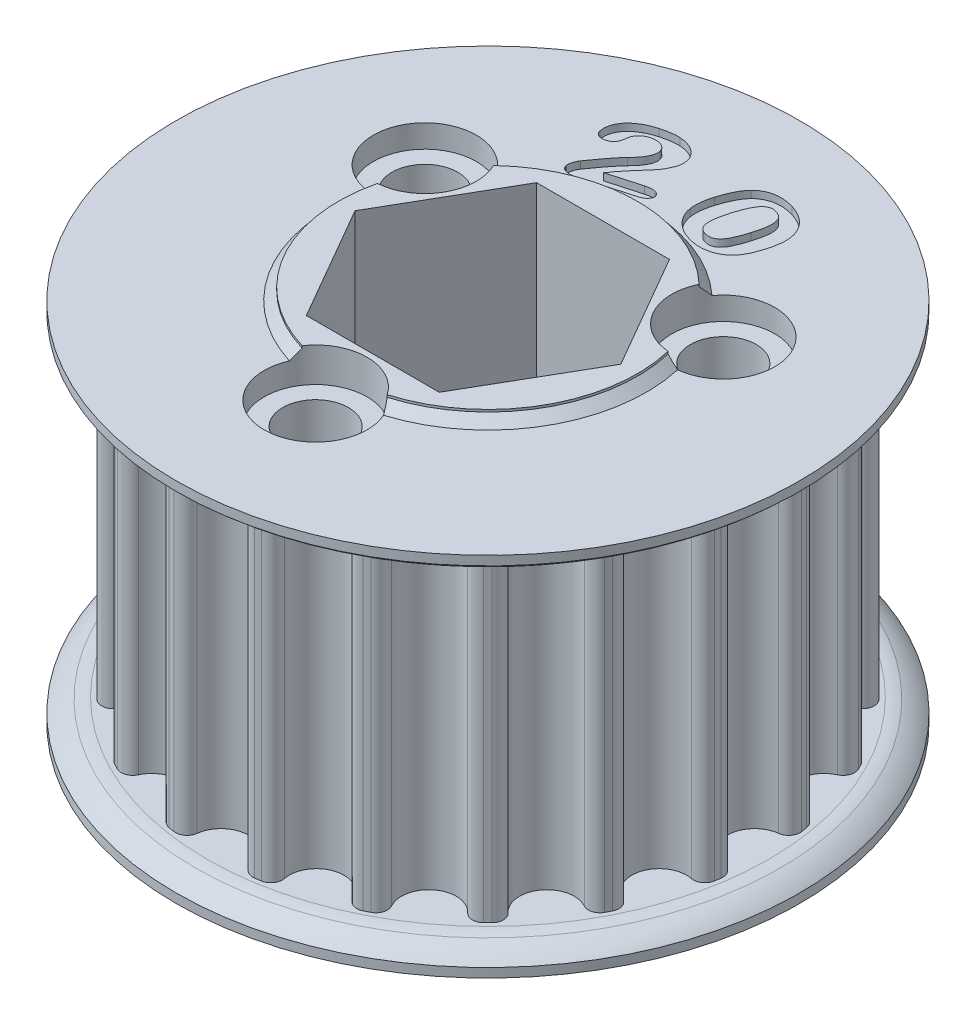
from build123d import *

# Parameters (mm, degrees)
SKETCH1_R               = 15.34399401
TOOTHOD_DEPTH           = 8.89
TOOTHPROFILE_DEPTH      = 29.053604124
TOOTHPATTERN_COUNT      = 20
SKETCH6_W               = 8.2931
SKETCH6_H               = 0.635
BORE_DEPTH              = 27.757745097
BORE_DEPTH_BACK         = 27.757745097
LARGE_TOOTH_COUNT_DEPTH = 0.4
CHAMFER1_SIZE           = 0.508
SKETCH11_R              = 12.3825
CUT_EXTRUDE2_DEPTH      = 3.302
SKETCH12_R              = 1.8288
CUT_EXTRUDE3_DEPTH      = 31.183991015
SKETCH13_R              = 12.3825
SKETCH13_R_2            = 1.35255
BOSS_EXTRUDE1_DEPTH     = 3.175
CUT_EXTRUDE4_DEPTH      = 32.817405686
CUT_EXTRUDE4_DEPTH_BACK = 1.27
SKETCH14_R              = 2.8575


with BuildPart() as part:
    # Sketch1 → ToothOD (new, symmetric)
    with BuildSketch(Plane(origin=(0, 0, 0), x_dir=(1, 0, 0), z_dir=(0, 1, 0))):
        with Locations(Location((0, 0, 0), (0, 0, 270))):
            Circle(SKETCH1_R)
    extrude(amount=TOOTHOD_DEPTH, both=True)

    # Sketch2 → ToothProfile (cut, through all)
    with BuildSketch(Plane(origin=(0, 8.89, 0), x_dir=(1, 0, 0), z_dir=(0, 1, 0))):
        with BuildLine():
            ThreePointArc((-1.514151189, 14.627414336), (0, 13.28399401), (1.514151189, 14.627414336))
            ThreePointArc((1.514151189, 14.627414336), (1.759047929, 15.056333772), (2.237219512, 15.180019797))
            ThreePointArc((2.237219512, 15.180019797), (0, 15.34399401), (-2.237219512, 15.180019797))
            ThreePointArc((-2.237219512, 15.180019797), (-1.759047929, 15.056333772), (-1.514151189, 14.627414336))
        make_face()
    toothprofile = extrude(amount=-TOOTHPROFILE_DEPTH, mode=Mode.SUBTRACT)

    # ToothPattern: ToothProfile ×20 about axis
    toothpattern_axis = Axis((0, 0, 0), (0, 1, 0))
    for i in range(1, TOOTHPATTERN_COUNT):
        add(toothprofile.rotate(toothpattern_axis, i * 360 / TOOTHPATTERN_COUNT), mode=Mode.SUBTRACT)

    # Sketch4 → Flange (revolve)
    with BuildSketch(Plane.XY, mode=Mode.PRIVATE) as flange_sk:
        with BuildLine():
            Line((0, -8.89), (15.59799401, -8.89))
            ThreePointArc((15.59799401, -8.89), (15.92375, -8.915622571), (16.243566338, -8.982637424))
            ThreePointArc((16.243566338, -8.982637424), (16.811294915, -9.264197125), (17.31249401, -9.652))
            Line((17.31249401, -9.652), (17.31249401, -10.16))
            Line((17.31249401, -10.16), (0, -10.16))
            Line((0, -10.16), (0, -8.89))
        make_face()
        with BuildLine():
            Line((17.31249401, 10.16), (17.31249401, 9.652))
            ThreePointArc((17.31249401, 9.652), (16.811294915, 9.264197125), (16.243566338, 8.982637424))
            ThreePointArc((16.243566338, 8.982637424), (15.92375, 8.915622571), (15.59799401, 8.89))
            Line((15.59799401, 8.89), (0, 8.89))
            Line((0, 8.89), (0, 10.16))
            Line((0, 10.16), (17.31249401, 10.16))
        make_face()
    revolve(flange_sk.sketch.rotate(Axis((0, 12.09802, 0), (0, -1, 0)), 90), axis=Axis((0, 12.09802, 0), (0, -1, 0)))

    # Sketch6 → TopBearingBoss (revolve)
    with BuildSketch(Plane.XY, mode=Mode.PRIVATE) as topbearingboss_sk:
        with Locations((4.14655, 10.4775)):
            Rectangle(SKETCH6_W, SKETCH6_H)
    revolve(topbearingboss_sk.sketch.rotate(Axis((0, 12.09802, 0), (0, -1, 0)), 90), axis=Axis((0, 12.09802, 0), (0, -1, 0)))

    # Sketch7 → Bore (cut, two sides: drawn at the far end of the back side and taken through both)
    with BuildSketch(Plane.XZ.offset(-BORE_DEPTH_BACK)):
        Polygon((3.688171255, 6.3881), (-3.688171255, 6.3881), (-7.376342509, 0), (-3.688171255, -6.3881), (3.688171255, -6.3881), (7.376342509, 0), align=None)
    extrude(amount=BORE_DEPTH + BORE_DEPTH_BACK, mode=Mode.SUBTRACT)

    # Sketch9 → Large Tooth Count (cut)
    # profile 1 of 2: a face of its own
    with BuildSketch(Plane(origin=(0, 10.16, 0), x_dir=(1, 0, 0), z_dir=(0, 1, 0))):
        with BuildLine():
            Line((-2.954146893, 9.361462675), (-1.175353143, 9.862418144))
            add(Edge.make_bspline(
                [(-1.175353143, 9.862418144), (-1.123805554, 9.875802418), (-1.026048459, 9.901184938), (-0.883304523, 9.919166454), (-0.754108312, 9.920384436), (-0.63935479, 9.903206029), (-0.541555305, 9.870084112), (-0.462297286, 9.823371078), (-0.402653568, 9.761037925), (-0.383751751, 9.709454292), (-0.374360174, 9.683824394)],
                knots=[0, 0, 0, 0, 1.416600478, 2.686502891, 3.819686855, 4.846312523, 5.7610532, 6.550671378, 7.279885059, 8, 8, 8, 8], degree=3))
            add(Edge.make_bspline(
                [(-0.374360174, 9.683824394), (-0.369719108, 9.660087819), (-0.360266106, 9.611740771), (-0.371972129, 9.535402151), (-0.403229262, 9.458544917), (-0.453267189, 9.380882786), (-0.526096867, 9.307089619), (-0.62160342, 9.241903313), (-0.739824812, 9.186663473), (-0.827592685, 9.159151), (-0.874422674, 9.144471269)],
                knots=[0, 0, 0, 0, 0.710365878, 1.446884956, 2.24079361, 3.150954831, 4.15871712, 5.283676882, 6.550661213, 8, 8, 8, 8], degree=3))
            Line((-0.874422674, 9.144471269), (-3.564937518, 8.387233769))
            add(Edge.make_bspline(
                [(-3.564937518, 8.387233769), (-3.61171521, 8.37543609), (-3.700837127, 8.352958886), (-3.832442975, 8.342282282), (-3.953746135, 8.349940914), (-4.062486177, 8.379695319), (-4.157127763, 8.424314562), (-4.233382296, 8.48426447), (-4.291165156, 8.557997927), (-4.311755017, 8.615372811), (-4.322175018, 8.644408769)],
                knots=[0, 0, 0, 0, 1.301754116, 2.480131396, 3.552996869, 4.569626462, 5.508600737, 6.361601131, 7.170848347, 8, 8, 8, 8], degree=3))
            add(Edge.make_bspline(
                [(-4.322175018, 8.644408769), (-4.326580812, 8.665164293), (-4.336073853, 8.709885638), (-4.332624611, 8.784411615), (-4.322455052, 8.869128107), (-4.299543845, 8.961161902), (-4.27034487, 9.054523865), (-4.235617728, 9.143365747), (-4.1961476, 9.224365129), (-4.163762464, 9.272780303), (-4.148046112, 9.296275956)],
                knots=[0, 0, 0, 0, 0.735191842, 1.58409722, 2.57532651, 3.702715511, 4.874795235, 5.976270416, 7.017893645, 8, 8, 8, 8], degree=3))
            add(Edge.make_bspline(
                [(-4.148046112, 9.296275956), (-4.087211058, 9.382429832), (-3.969092279, 9.549708234), (-3.794337723, 9.790740454), (-3.627134069, 10.014150132), (-3.493100044, 10.188605296), (-3.391151145, 10.317214682), (-3.321382624, 10.403735091), (-3.257675155, 10.482773388), (-3.197071967, 10.55186435), (-3.144281079, 10.614722485), (-3.095438484, 10.668632161), (-3.052483765, 10.714698958), (-3.024770261, 10.742069301), (-3.012189862, 10.754493925)],
                knots=[0, 0, 0, 0, 2.052272746, 3.984741291, 5.793026345, 7.482136723, 8.265501849, 8.986445627, 9.645011633, 10.240581551, 10.774583818, 11.242129634, 11.655968724, 12, 12, 12, 12], degree=3))
            add(Edge.make_bspline(
                [(-3.012189862, 10.754493925), (-2.97279762, 10.794299168), (-2.896763622, 10.871130331), (-2.792806568, 10.988869332), (-2.701039663, 11.102694717), (-2.620574498, 11.212717556), (-2.553383732, 11.320286413), (-2.497592916, 11.424476859), (-2.454002898, 11.526306534), (-2.422746917, 11.625053273), (-2.402709489, 11.71988848), (-2.394004008, 11.810101015), (-2.397937406, 11.895345873), (-2.409888983, 11.949103964), (-2.415686737, 11.975182206)],
                knots=[0, 0, 0, 0, 1.423552018, 2.747707314, 3.991028065, 5.139956742, 6.210844286, 7.212885815, 8.141975106, 9.022746377, 9.842005735, 10.601823445, 11.321739559, 12, 12, 12, 12], degree=3))
            add(Edge.make_bspline(
                [(-2.415686737, 11.975182206), (-2.42429087, 12.001758675), (-2.441249197, 12.0541396), (-2.482578582, 12.125664714), (-2.535327991, 12.18909487), (-2.598872825, 12.244238856), (-2.671873029, 12.2906639), (-2.752660218, 12.328719573), (-2.842148698, 12.355153399), (-2.938047159, 12.37159083), (-3.038305704, 12.378979246), (-3.141121707, 12.374657925), (-3.245814936, 12.36229657), (-3.314774119, 12.344214881), (-3.349732049, 12.335048613)],
                knots=[0, 0, 0, 0, 0.90254133, 1.778864972, 2.655082592, 3.563625712, 4.491394034, 5.448683676, 6.445761391, 7.502723384, 8.594618504, 9.694102356, 10.831056182, 12, 12, 12, 12], degree=3))
            add(Edge.make_bspline(
                [(-3.349732049, 12.335048613), (-3.382418939, 12.324700344), (-3.446620887, 12.304374794), (-3.537125411, 12.263067652), (-3.620087769, 12.213267396), (-3.696565155, 12.156329349), (-3.765107736, 12.089722279), (-3.824340499, 12.013694183), (-3.879435722, 11.931578737), (-3.907718253, 11.87113381), (-3.922125018, 11.840343925)],
                knots=[0, 0, 0, 0, 1.049930399, 2.062220621, 3.039893766, 4.010392484, 4.977929152, 5.957982101, 6.959821796, 8, 8, 8, 8], degree=3))
            add(Edge.make_bspline(
                [(-3.922125018, 11.840343925), (-3.924346544, 11.832933466), (-3.931168204, 11.810178107), (-3.937056605, 11.762522536), (-3.950091222, 11.690823835), (-3.961933852, 11.598900745), (-3.979992527, 11.497578612), (-4.007626887, 11.398655278), (-4.042740729, 11.30637416), (-4.085519388, 11.220216479), (-4.144929258, 11.141703059), (-4.227777014, 11.077150199), (-4.330942518, 11.022005189), (-4.409730011, 10.997774061), (-4.451655487, 10.984879863)],
                knots=[0, 0, 0, 0, 0.255495149, 0.784551133, 1.582182714, 2.666380175, 3.847664823, 4.981851255, 6.056538028, 7.108499466, 8.153764709, 9.280368537, 10.552792622, 12, 12, 12, 12], degree=3))
            add(Edge.make_bspline(
                [(-4.451655487, 10.984879863), (-4.484518593, 10.977014405), (-4.548160913, 10.961782248), (-4.644496368, 10.956258535), (-4.73670461, 10.966954595), (-4.82346759, 10.993238394), (-4.901057808, 11.035922061), (-4.965744414, 11.095093645), (-5.016154224, 11.169717324), (-5.035502925, 11.227460955), (-5.045479705, 11.257235331)],
                knots=[0, 0, 0, 0, 1.104655038, 2.139262494, 3.14009217, 4.129518318, 5.089274639, 6.013546725, 6.975724119, 8, 8, 8, 8], degree=3))
            add(Edge.make_bspline(
                [(-5.045479705, 11.257235331), (-5.05397104, 11.293084372), (-5.071349422, 11.366453082), (-5.077754738, 11.481958813), (-5.072725552, 11.603249079), (-5.051844202, 11.729081667), (-5.016292017, 11.857336166), (-4.964770167, 11.985211731), (-4.897422878, 12.111016582), (-4.814660026, 12.23509846), (-4.715205717, 12.356092866), (-4.597286749, 12.47195975), (-4.46284857, 12.584034957), (-4.31031455, 12.689978389), (-4.14049305, 12.79094259), (-3.950695814, 12.87981994), (-3.743341884, 12.961365981), (-3.596866185, 13.004705712), (-3.521182049, 13.027099394)],
                knots=[0, 0, 0, 0, 0.684205447, 1.400296104, 2.14308195, 2.939673375, 3.767285031, 4.614614734, 5.499007285, 6.417452817, 7.385287256, 8.407291256, 9.488547988, 10.637669497, 11.859015001, 13.159415024, 14.532266988, 16, 16, 16, 16], degree=3))
            add(Edge.make_bspline(
                [(-3.521182049, 13.027099394), (-3.4736299, 13.03988753), (-3.380335158, 13.064977161), (-3.241544955, 13.097089226), (-3.107026771, 13.124112364), (-2.976265984, 13.14490228), (-2.8495897, 13.158917372), (-2.727192142, 13.168269746), (-2.608850533, 13.171070654), (-2.531470246, 13.16854091), (-2.493375018, 13.167295488)],
                knots=[0, 0, 0, 0, 1.134348345, 2.225530054, 3.281228752, 4.294749574, 5.274655805, 6.216612838, 7.122017479, 8, 8, 8, 8], degree=3))
            add(Edge.make_bspline(
                [(-2.493375018, 13.167295488), (-2.439709954, 13.16272022), (-2.334541326, 13.153753966), (-2.181332224, 13.127305431), (-2.036981563, 13.087440761), (-1.901006644, 13.037993111), (-1.775042238, 12.977076771), (-1.658865503, 12.907098719), (-1.552797444, 12.827923999), (-1.459758972, 12.738048259), (-1.376703421, 12.643511102), (-1.309975797, 12.541360057), (-1.254518112, 12.43604159), (-1.230849347, 12.361372234), (-1.219108612, 12.324332988)],
                knots=[0, 0, 0, 0, 1.190830805, 2.333697818, 3.432410255, 4.498757827, 5.529248872, 6.521607877, 7.494563189, 8.449082834, 9.378017597, 10.270819197, 11.142251172, 12, 12, 12, 12], degree=3))
            add(Edge.make_bspline(
                [(-1.219108612, 12.324332988), (-1.211383801, 12.294688493), (-1.195989155, 12.235610479), (-1.183332882, 12.145192252), (-1.176603551, 12.054774787), (-1.178486449, 11.963899215), (-1.188610174, 11.872881101), (-1.205430531, 11.781423706), (-1.230525716, 11.690002431), (-1.274849659, 11.570781829), (-1.33741533, 11.429640428), (-1.41591175, 11.271086939), (-1.50151055, 11.130952631), (-1.579521706, 11.024672795), (-1.647287016, 10.941396881), (-1.706925628, 10.872235184), (-1.772228142, 10.792201909), (-1.847731998, 10.704799598), (-1.931711291, 10.608913676), (-2.022333861, 10.502919779), (-2.123153923, 10.389883416), (-2.227945717, 10.269423426), (-2.334199707, 10.149850826), (-2.432223405, 10.033064938), (-2.522427016, 9.924904713), (-2.603216232, 9.823238211), (-2.675411176, 9.729477266), (-2.73794607, 9.642126083), (-2.79312732, 9.563443557), (-2.824329241, 9.511648282), (-2.838953924, 9.487371269)],
                knots=[0, 0, 0, 0, 0.759348993, 1.513293812, 2.260847921, 3.006759253, 3.764275153, 4.530379131, 5.311389733, 6.112558984, 7.683247224, 9.139506665, 10.498308862, 11.750708933, 12.406871982, 13.161322828, 14.015965315, 14.96902083, 16.02622199, 17.177907503, 18.428216246, 19.783402464, 21.138588682, 22.396006758, 23.565473171, 24.632146706, 25.617187237, 26.500440687, 27.297140101, 28, 28, 28, 28], degree=3))
            add(Edge.make_bspline(
                [(-2.838953924, 9.487371269), (-2.855289837, 9.463900755), (-2.888073876, 9.416798504), (-2.932072354, 9.379949994), (-2.954146893, 9.361462675)],
                knots=[0, 0, 0, 0, 0.996577163, 2, 2, 2, 2], degree=3))
        make_face()
    # profile 2 of 2: a face of its own
    with BuildSketch(Plane(origin=(0, 10.16, 0), x_dir=(1, 0, 0), z_dir=(0, 1, 0))):
        with BuildLine():
            add(Edge.make_bspline(
                [(5.214409045, 10.150130338), (5.190714867, 10.074880459), (5.1449507, 9.929538937), (5.067123561, 9.722992573), (4.985074358, 9.534662094), (4.897683151, 9.362490125), (4.797990216, 9.204699763), (4.68207819, 9.059315083), (4.548391417, 8.924355594), (4.448207144, 8.844811647), (4.397342639, 8.804426432)],
                knots=[0, 0, 0, 0, 1.18011728, 2.279339777, 3.300312696, 4.252335004, 5.165279864, 6.087474786, 7.028992811, 8, 8, 8, 8], degree=3))
            add(Edge.make_bspline(
                [(4.397342639, 8.804426432), (4.368452389, 8.783759012), (4.310444351, 8.742261398), (4.218090567, 8.68760354), (4.122567032, 8.636381907), (4.021053968, 8.594804769), (3.917071626, 8.55542857), (3.807864453, 8.524522636), (3.694856927, 8.498897601), (3.578149786, 8.477916033), (3.458784674, 8.465052918), (3.337809148, 8.457659325), (3.215789514, 8.457269131), (3.092816601, 8.466425015), (2.968336345, 8.478893397), (2.842901635, 8.500737733), (2.716334551, 8.529457806), (2.632441476, 8.553128463), (2.589973889, 8.565110807)],
                knots=[0, 0, 0, 0, 0.901536881, 1.810174201, 2.722951407, 3.650873295, 4.592999596, 5.545017892, 6.529601249, 7.5348545, 8.553963068, 9.576094043, 10.611551205, 11.649240286, 12.705913058, 13.786930103, 14.879719961, 16, 16, 16, 16], degree=3))
            add(Edge.make_bspline(
                [(2.589973889, 8.565110807), (2.543632445, 8.579700214), (2.452042396, 8.608534977), (2.319678008, 8.661606647), (2.193694452, 8.721556974), (2.07328836, 8.787716416), (1.959122861, 8.861323411), (1.84975651, 8.940228266), (1.747631416, 9.027720056), (1.651608943, 9.121077228), (1.562444683, 9.219388851), (1.482907007, 9.322900319), (1.410803045, 9.429205404), (1.348352462, 9.54012966), (1.294619283, 9.655154495), (1.248761777, 9.773672505), (1.213020235, 9.896616587), (1.195786369, 9.980335913), (1.187119983, 10.022435807)],
                knots=[0, 0, 0, 0, 1.093974974, 2.162151445, 3.208754958, 4.235018977, 5.254163096, 6.266603484, 7.270125483, 8.279987647, 9.281626696, 10.256545703, 11.217884655, 12.172537706, 13.120291723, 14.075274297, 15.032114198, 16, 16, 16, 16], degree=3))
            add(Edge.make_bspline(
                [(1.187119983, 10.022435807), (1.180867164, 10.069996862), (1.168240345, 10.166040708), (1.1601745, 10.312869392), (1.163621366, 10.463459377), (1.174789304, 10.6179706), (1.197160825, 10.776345136), (1.22609065, 10.938288092), (1.264806684, 11.103647427), (1.296751927, 11.213792398), (1.313028577, 11.26991315)],
                knots=[0, 0, 0, 0, 0.910485463, 1.838616153, 2.788107085, 3.768457025, 4.77780678, 5.823027201, 6.890795017, 8, 8, 8, 8], degree=3))
            add(Edge.make_bspline(
                [(1.313028577, 11.26991315), (1.33538935, 11.341535758), (1.379078841, 11.481475247), (1.452154195, 11.682542865), (1.529127683, 11.87032368), (1.609998022, 12.044290335), (1.6952769, 12.205137541), (1.787378592, 12.350429447), (1.883615047, 12.482465752), (1.954403412, 12.561103972), (1.98900592, 12.599543619)],
                knots=[0, 0, 0, 0, 1.196779593, 2.338322093, 3.411423727, 4.433178792, 5.397622731, 6.313149774, 7.175440056, 8, 8, 8, 8], degree=3))
            add(Edge.make_bspline(
                [(1.98900592, 12.599543619), (2.018628391, 12.628603845), (2.077103584, 12.685969161), (2.171791495, 12.762895464), (2.270271079, 12.832357217), (2.373785475, 12.892330016), (2.480624357, 12.946184702), (2.592696711, 12.989493011), (2.708793143, 13.025239338), (2.829056329, 13.052964555), (2.952560802, 13.072627552), (3.079412612, 13.083143097), (3.208835866, 13.085694737), (3.341290865, 13.080548732), (3.476299628, 13.065774952), (3.61437117, 13.043471927), (3.75507657, 13.012338384), (3.848891552, 12.985499356), (3.89638717, 12.971911588)],
                knots=[0, 0, 0, 0, 0.971271056, 1.917303395, 2.853215794, 3.790451001, 4.716264034, 5.652098562, 6.6001573, 7.558841376, 8.539768638, 9.526129073, 10.537034007, 11.569480832, 12.627883147, 13.715356414, 14.843355738, 16, 16, 16, 16], degree=3))
            add(Edge.make_bspline(
                [(3.89638717, 12.971911588), (3.961047138, 12.951501287), (4.087573261, 12.911562568), (4.26784755, 12.835416509), (4.436188729, 12.750440953), (4.590932452, 12.653297499), (4.733128735, 12.548330058), (4.861794309, 12.434592971), (4.975915242, 12.311534463), (5.075655196, 12.180079229), (5.162485109, 12.042696768), (5.235003627, 11.900099386), (5.294184558, 11.753211843), (5.321379679, 11.651830378), (5.334959827, 11.601204557)],
                knots=[0, 0, 0, 0, 1.170483588, 2.290393202, 3.375582303, 4.424020791, 5.441917151, 6.425119279, 7.385477153, 8.335528901, 9.2711732, 10.18851884, 11.095419263, 12, 12, 12, 12], degree=3))
            add(Edge.make_bspline(
                [(5.334959827, 11.601204557), (5.345438057, 11.551051125), (5.366875769, 11.448440786), (5.381402987, 11.288093713), (5.386496657, 11.119523422), (5.37668279, 10.94229087), (5.355085027, 10.756243659), (5.320633311, 10.561374709), (5.274470628, 10.357721475), (5.234765054, 10.220486907), (5.214409045, 10.150130338)],
                knots=[0, 0, 0, 0, 0.834578345, 1.707487665, 2.620008346, 3.581952147, 4.597888727, 5.671599988, 6.806290297, 8, 8, 8, 8], degree=3))
        make_face()
        with BuildLine():
            add(Edge.make_bspline(
                [(4.031225452, 10.56982565), (4.04357031, 10.611754452), (4.067764283, 10.693928279), (4.100757692, 10.814739321), (4.129381589, 10.930615781), (4.154607751, 11.040966004), (4.17517115, 11.146384723), (4.191469661, 11.246428339), (4.20286392, 11.341205651), (4.213841097, 11.457443534), (4.216752136, 11.592054856), (4.202110036, 11.740591906), (4.171074433, 11.872605872), (4.127424694, 11.969388232), (4.083881673, 12.037912926), (4.045434796, 12.084373108), (4.000776302, 12.126406709), (3.951930174, 12.1663729), (3.895704752, 12.200546592), (3.835309816, 12.2331379), (3.768732382, 12.260690902), (3.722073138, 12.275724197), (3.698148108, 12.283432682)],
                knots=[0, 0, 0, 0, 1.326170746, 2.599085169, 3.799445801, 4.94753492, 6.033295135, 7.057791564, 8.022292309, 8.929082325, 10.600110398, 12.098179301, 13.447489324, 14.696469786, 15.297719383, 15.907121204, 16.520325778, 17.15644649, 17.817961626, 18.512851169, 19.237448412, 20, 20, 20, 20], degree=3))
            add(Edge.make_bspline(
                [(3.698148108, 12.283432682), (3.667653286, 12.291427612), (3.608467335, 12.306944593), (3.518859453, 12.315603473), (3.43228089, 12.313007472), (3.348970179, 12.294162773), (3.268843326, 12.263717987), (3.191916068, 12.219918135), (3.118272519, 12.163156193), (3.048551775, 12.092068958), (2.979738045, 12.008223912), (2.914539397, 11.907932136), (2.848206908, 11.793856803), (2.784246551, 11.663475333), (2.721164908, 11.517923561), (2.658918626, 11.35696549), (2.597074002, 11.180720122), (2.558899013, 11.057224397), (2.53907467, 10.993092838)],
                knots=[0, 0, 0, 0, 0.779608217, 1.513104545, 2.221386719, 2.915408799, 3.617719978, 4.337304937, 5.09957383, 5.912718864, 6.798071582, 7.781475227, 8.871367297, 10.064760717, 11.37536222, 12.799043681, 14.337737445, 16, 16, 16, 16], degree=3))
            add(Edge.make_bspline(
                [(2.53907467, 10.993092838), (2.525780531, 10.948798919), (2.499803053, 10.862246169), (2.465057265, 10.73449515), (2.434565149, 10.612447484), (2.409051423, 10.496192633), (2.385689628, 10.386027538), (2.369510135, 10.280960181), (2.355595424, 10.18190809), (2.343868918, 10.061130514), (2.339639419, 9.922828249), (2.350968028, 9.771566451), (2.3796989, 9.639943096), (2.426133084, 9.526879767), (2.492105714, 9.432454634), (2.5754877, 9.355240728), (2.675763288, 9.292853541), (2.751545994, 9.266420565), (2.790891858, 9.252696744)],
                knots=[0, 0, 0, 0, 1.129632941, 2.207364826, 3.233713364, 4.202180195, 5.114802594, 5.983834708, 6.798254548, 7.557928904, 8.947170659, 10.172937136, 11.254195191, 12.225169878, 13.138921205, 14.044331844, 14.984630429, 16, 16, 16, 16], degree=3))
            add(Edge.make_bspline(
                [(2.790891858, 9.252696744), (2.81520806, 9.24606045), (2.862572058, 9.233134031), (2.933678635, 9.220591584), (3.00207604, 9.214307045), (3.068211057, 9.213853312), (3.131658175, 9.221202469), (3.192706609, 9.234608636), (3.251390292, 9.254092676), (3.326480383, 9.29123363), (3.417640784, 9.352659395), (3.517714155, 9.450500325), (3.613187275, 9.570539223), (3.684054974, 9.688732373), (3.739933925, 9.794808606), (3.782672042, 9.883814369), (3.824376633, 9.980554467), (3.866377238, 10.084159167), (3.908185032, 10.194975421), (3.950511202, 10.312951239), (3.99116818, 10.438835364), (4.017651783, 10.525438733), (4.031225452, 10.56982565)],
                knots=[0, 0, 0, 0, 0.740928597, 1.443208135, 2.119986108, 2.75897178, 3.38438367, 3.99391264, 4.594578025, 5.197471523, 6.452606339, 7.808452879, 9.297145185, 10.951528506, 11.852090658, 12.823028486, 13.854016112, 14.949569282, 16.110321297, 17.336804467, 18.635029525, 20, 20, 20, 20], degree=3))
        make_face(mode=Mode.SUBTRACT)
    extrude(amount=-LARGE_TOOTH_COUNT_DEPTH, mode=Mode.SUBTRACT)

    # Chamfer1
    chamfer1_edges = [part.edges().sort_by_distance(p)[0] for p in [
        (0, 10.16, -8.2931),
    ]]
    chamfer(chamfer1_edges, length=CHAMFER1_SIZE)

    # Sketch11 → Cut-Extrude2 (cut)
    with BuildSketch(Plane.XZ.offset(10.16)):
        with Locations(Location((0, 0, 0), (0, 0, 270))):
            Circle(SKETCH11_R)
    extrude(amount=-CUT_EXTRUDE2_DEPTH, mode=Mode.SUBTRACT)

    # Sketch12 → Cut-Extrude3 (cut, through all)
    with BuildSketch(Plane.XZ.offset(6.858)):
        with Locations(Location((0, 9.5631, 0), (0, 0, 270))):
            Circle(SKETCH12_R)
        with Locations(Location((8.281887539, -4.78155, 0), (0, 0, 270))):
            Circle(SKETCH12_R)
        with Locations(Location((-8.281887539, -4.78155, 0), (0, 0, 270))):
            Circle(SKETCH12_R)
    extrude(amount=-CUT_EXTRUDE3_DEPTH, mode=Mode.SUBTRACT)

    # Sketch14 → Cut-Extrude4 (cut, two sides: drawn at the far end of the back side and taken through both)
    with BuildSketch(Plane(origin=(0, 10.16, 0), x_dir=(1, 0, 0), z_dir=(0, 1, 0)).offset(-CUT_EXTRUDE4_DEPTH_BACK)):
        with Locations(Location((-8.281887539, 4.78155, 0), (0, 0, 274.356142719))):
            Circle(SKETCH14_R)
        with Locations(Location((8.281887539, 4.78155, 0), (0, 0, 265.643857281))):
            Circle(SKETCH14_R)
        with Locations(Location((0, -9.5631, 0), (0, 0, 156.080990941))):
            Circle(SKETCH14_R)
    extrude(amount=CUT_EXTRUDE4_DEPTH + CUT_EXTRUDE4_DEPTH_BACK, mode=Mode.SUBTRACT)


with BuildPart() as body_2:
    # Sketch13 → Boss-Extrude1 (new body)
    with BuildSketch(Plane.XZ.offset(10.16)):
        with Locations(Location((0, 0, 0), (0, 0, 270))):
            Circle(SKETCH13_R)
        with Locations(Location((-8.281887539, -4.78155, 0), (0, 0, 270))):
            Circle(SKETCH13_R_2, mode=Mode.SUBTRACT)
        with Locations(Location((0, 9.5631, 0), (0, 0, 270))):
            Circle(SKETCH13_R_2, mode=Mode.SUBTRACT)
        with Locations(Location((8.281887539, -4.78155, 0), (0, 0, 270))):
            Circle(SKETCH13_R_2, mode=Mode.SUBTRACT)
        Polygon((7.376342509, 0), (3.688171255, -6.3881), (-3.688171255, -6.3881), (-7.376342509, 0), (-3.688171255, 6.3881), (3.688171255, 6.3881), align=None, mode=Mode.SUBTRACT)
    extrude(amount=-BOSS_EXTRUDE1_DEPTH)


solid = Compound([part.part, body_2.part])
